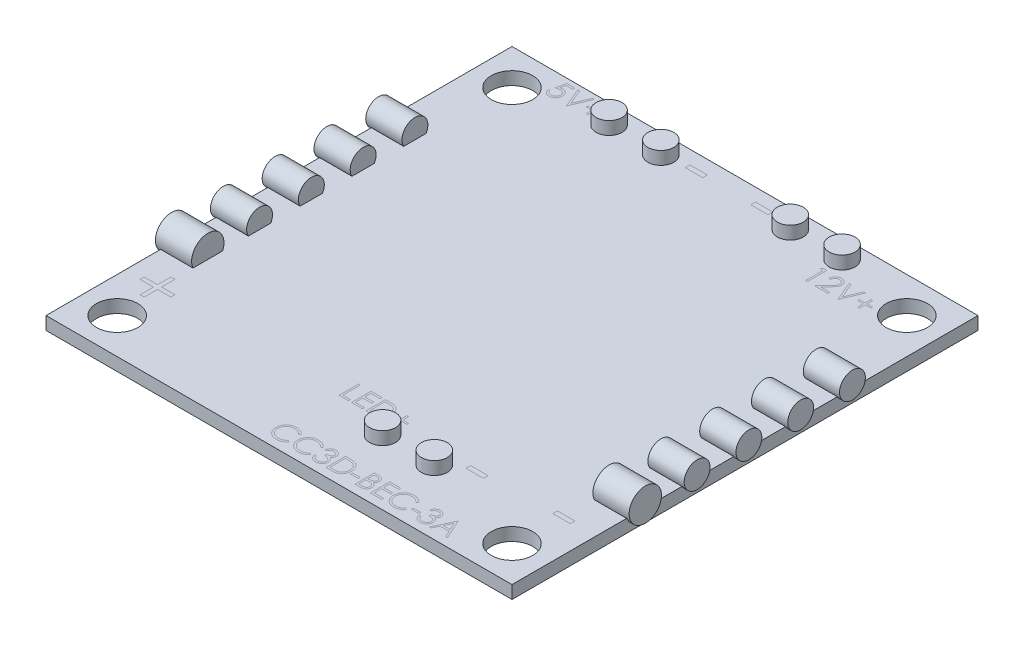
from build123d import *

# Parameters (mm, degrees)
SKIZZE1_W                        = 36
SKIZZE1_H                        = 36
PLATINE_DEPTH                    = 1
F_3_2_3_2_DURCHMESSER_BOHRUNG1_D = 3.2
ANSCHLUESSE_MINUS_DEPTH          = 0.3
ANSCHLUESSE_MINUS_DEPTH_BACK     = 2.5
SKIZZE5_R                        = 1.25
SKIZZE5_R_2                      = 1
ANSCHLUESSE_PLUS_DEPTH           = 0.3
ANSCHLUESSE_PLUS_DEPTH_BACK      = 2.5
SKIZZE6_R                        = 1
SKIZZE6_R_2                      = 1.25
SKIZZE7_R                        = 1
SKUND_RANSCHL_SSE_DEPTH          = 1


with BuildPart() as part:
    # Skizze1 → Platine (new body)
    with BuildSketch(Plane(origin=(0, 0, 0), x_dir=(1, 0, 0), z_dir=(0, 1, 0))):
        Rectangle(SKIZZE1_W, SKIZZE1_H)
    extrude(amount=PLATINE_DEPTH)

    # Ø3.2 (3.2) Durchmesser Bohrung1 (through all)
    with Locations(Plane(origin=(0, 1, 0), x_dir=(1, 0, 0), z_dir=(0, 1, 0))):
        with Locations((-15.25, 15.25), (15.25, 15.25), (15.25, -15.25), (-15.25, -15.25)):
            Hole(F_3_2_3_2_DURCHMESSER_BOHRUNG1_D / 2)

    # Skizze5 → Anschluesse_Minus (add, two sides: drawn at the far end of the back side and taken through both)
    with BuildSketch(Plane(origin=(18, 0, 0), x_dir=(0, 0, -1), z_dir=(1, 0, 0)).offset(-ANSCHLUESSE_MINUS_DEPTH_BACK)):
        with Locations((-8, 1.5)):
            Circle(SKIZZE5_R)
        with Locations((-4, 1.5)):
            Circle(SKIZZE5_R_2)
        with Locations((0, 1.5)):
            Circle(SKIZZE5_R_2)
        with Locations((4, 1.5)):
            Circle(SKIZZE5_R_2)
        with Locations((8, 1.5)):
            Circle(SKIZZE5_R_2)
    extrude(amount=ANSCHLUESSE_MINUS_DEPTH + ANSCHLUESSE_MINUS_DEPTH_BACK)

    # Skizze6 → Anschluesse_Plus (add, two sides: drawn at the far end of the back side and taken through both)
    with BuildSketch(Plane.ZY.offset(18).offset(-ANSCHLUESSE_PLUS_DEPTH_BACK)):
        with Locations((-8, 1.5)):
            Circle(SKIZZE6_R)
        with Locations((-4, 1.5)):
            Circle(SKIZZE6_R)
        with Locations((0, 1.5)):
            Circle(SKIZZE6_R)
        with Locations((4, 1.5)):
            Circle(SKIZZE6_R)
        with Locations((8, 1.5)):
            Circle(SKIZZE6_R_2)
    extrude(amount=ANSCHLUESSE_PLUS_DEPTH + ANSCHLUESSE_PLUS_DEPTH_BACK)

    # Skizze7 → Skundäranschlüsse (add)
    with BuildSketch(Plane(origin=(0, 1, 0), x_dir=(1, 0, 0), z_dir=(0, 1, 0))):
        with Locations((-9, 16.5)):
            Circle(SKIZZE7_R)
        with Locations((-5, 16.5)):
            Circle(SKIZZE7_R)
        with Locations((5, 16.5)):
            Circle(SKIZZE7_R)
        with Locations((9, 16.5)):
            Circle(SKIZZE7_R)
        with Locations((3, -13)):
            Circle(SKIZZE7_R)
        with Locations((7, -13)):
            Circle(SKIZZE7_R)
    extrude(amount=SKUND_RANSCHL_SSE_DEPTH)


solid = part.part
